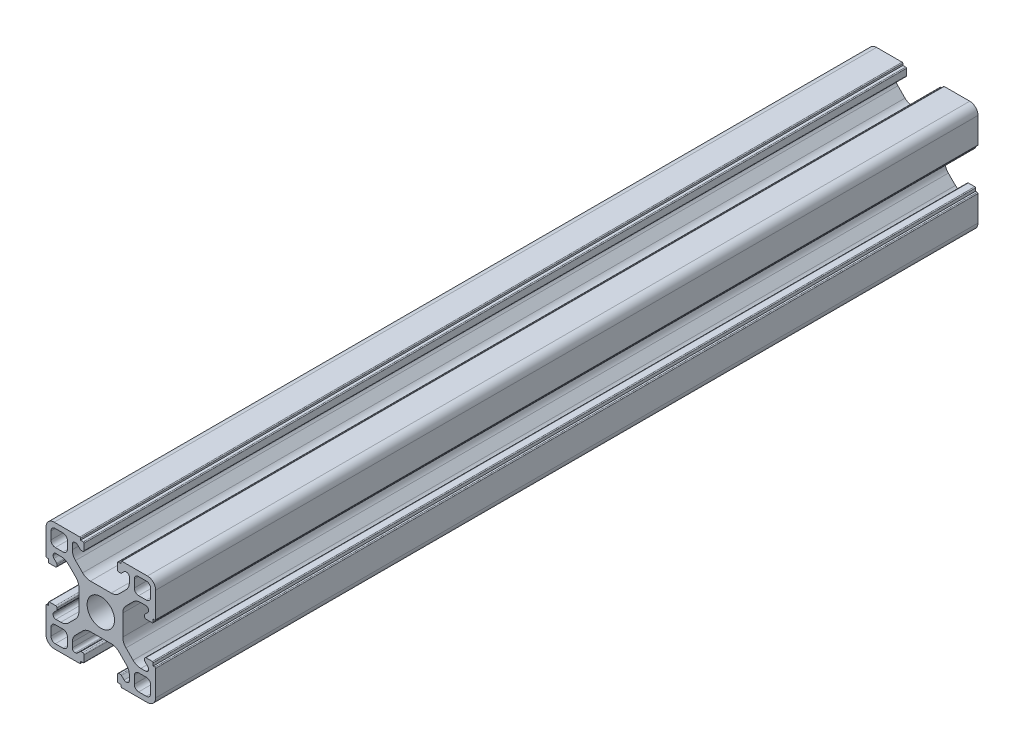
from build123d import *

# Parameters (mm, degrees)
EXTRUDE_1_DEPTH = 150


with BuildPart() as part:
    # Эскиз1 → Бобышка-Вытянуть1 (new body)
    with BuildSketch(Plane.XY):
        with BuildLine():
            Line((-31.105150957, 65.209647948), (-29.206370287, 65.209647948))
            ThreePointArc((-29.206370287, 65.209647948), (-28.441003423, 65.361888883), (-27.792156725, 65.795434385))
            Line((-27.792156725, 65.795434385), (-26.490937394, 67.096653716))
            ThreePointArc((-26.490937394, 67.096653716), (-26.057391892, 67.745500414), (-25.905150957, 68.510867279))
            Line((-25.905150957, 68.510867279), (-25.905150957, 69.409647948))
            ThreePointArc((-25.905150957, 69.409647948), (-26.051597566, 69.763201338), (-26.405150957, 69.909647948))
            Line((-26.405150957, 69.909647948), (-26.508044175, 69.909647948))
            ThreePointArc((-26.508044175, 69.909647948), (-26.699385892, 69.871587714), (-26.861597566, 69.763201338))
            Line((-26.861597566, 69.763201338), (-27.341927652, 69.282871252))
            ThreePointArc((-27.341927652, 69.282871252), (-27.423033489, 69.228678065), (-27.518704347, 69.209647948))
            Line((-27.518704347, 69.209647948), (-27.805150957, 69.209647948))
            ThreePointArc((-27.805150957, 69.209647948), (-27.981927652, 69.282871252), (-28.055150957, 69.459647948))
            Line((-28.055150957, 69.459647948), (-28.055150957, 70.608718768))
            ThreePointArc((-28.055150957, 70.608718768), (-28.011216974, 70.714784785), (-27.905150957, 70.758718768))
            Line((-27.905150957, 70.758718768), (-27.405150957, 70.758718768))
            Line((-27.405150957, 70.758718768), (-27.405150957, 71.059647948))
            ThreePointArc((-27.405150957, 71.059647948), (-27.361216974, 71.165713965), (-27.255150957, 71.209647948))
            Line((-27.255150957, 71.209647948), (-22.605150957, 71.209647948))
            ThreePointArc((-22.605150957, 71.209647948), (-21.544490785, 70.770308119), (-21.105150957, 69.709647948))
            Line((-21.105150957, 69.709647948), (-21.105150957, 65.059647948))
            ThreePointArc((-21.105150957, 65.059647948), (-21.149084939, 64.953581931), (-21.255150957, 64.909647948))
            Line((-21.255150957, 64.909647948), (-21.556080136, 64.909647948))
            Line((-21.556080136, 64.909647948), (-21.556080136, 64.409647948))
            ThreePointArc((-21.556080136, 64.409647948), (-21.600014119, 64.303581931), (-21.706080136, 64.259647948))
            Line((-21.706080136, 64.259647948), (-22.855150957, 64.259647948))
            ThreePointArc((-22.855150957, 64.259647948), (-23.031927652, 64.332871252), (-23.105150957, 64.509647948))
            Line((-23.105150957, 64.509647948), (-23.105150957, 64.796094557))
            ThreePointArc((-23.105150957, 64.796094557), (-23.08612084, 64.891765415), (-23.031927652, 64.972871252))
            Line((-23.031927652, 64.972871252), (-22.551597566, 65.453201338))
            ThreePointArc((-22.551597566, 65.453201338), (-22.44321119, 65.615413013), (-22.405150957, 65.806754729))
            Line((-22.405150957, 65.806754729), (-22.405150957, 65.909647948))
            ThreePointArc((-22.405150957, 65.909647948), (-22.551597566, 66.263201338), (-22.905150957, 66.409647948))
            Line((-22.905150957, 66.409647948), (-23.803931626, 66.409647948))
            ThreePointArc((-23.803931626, 66.409647948), (-24.56929849, 66.257407013), (-25.218145188, 65.82386151))
            Line((-25.218145188, 65.82386151), (-26.519364519, 64.522642179))
            ThreePointArc((-26.519364519, 64.522642179), (-26.952910022, 63.873795482), (-27.105150957, 63.108428617))
            Line((-27.105150957, 63.108428617), (-27.105150957, 61.209647948))
            Line((-27.105150957, 61.209647948), (-27.105150957, 59.310867279))
            ThreePointArc((-27.105150957, 59.310867279), (-26.952910022, 58.545500414), (-26.519364519, 57.896653716))
            Line((-26.519364519, 57.896653716), (-25.218145188, 56.595434385))
            ThreePointArc((-25.218145188, 56.595434385), (-24.56929849, 56.161888883), (-23.803931626, 56.009647948))
            Line((-23.803931626, 56.009647948), (-22.905150957, 56.009647948))
            ThreePointArc((-22.905150957, 56.009647948), (-22.551597566, 56.156094557), (-22.405150957, 56.509647948))
            Line((-22.405150957, 56.509647948), (-22.405150957, 56.612541166))
            ThreePointArc((-22.405150957, 56.612541166), (-22.44321119, 56.803882883), (-22.551597566, 56.966094557))
            Line((-22.551597566, 56.966094557), (-23.031927652, 57.446424643))
            ThreePointArc((-23.031927652, 57.446424643), (-23.08612084, 57.52753048), (-23.105150957, 57.623201338))
            Line((-23.105150957, 57.623201338), (-23.105150957, 57.909647948))
            ThreePointArc((-23.105150957, 57.909647948), (-23.031927652, 58.086424643), (-22.855150957, 58.159647948))
            Line((-22.855150957, 58.159647948), (-21.706080136, 58.159647948))
            ThreePointArc((-21.706080136, 58.159647948), (-21.600014119, 58.115713965), (-21.556080136, 58.009647948))
            Line((-21.556080136, 58.009647948), (-21.556080136, 57.509647948))
            Line((-21.556080136, 57.509647948), (-21.255150957, 57.509647948))
            ThreePointArc((-21.255150957, 57.509647948), (-21.149084939, 57.465713965), (-21.105150957, 57.359647948))
            Line((-21.105150957, 57.359647948), (-21.105150957, 52.709647948))
            ThreePointArc((-21.105150957, 52.709647948), (-21.544490785, 51.648987776), (-22.605150957, 51.209647948))
            Line((-22.605150957, 51.209647948), (-27.255150957, 51.209647948))
            ThreePointArc((-27.255150957, 51.209647948), (-27.361216974, 51.253581931), (-27.405150957, 51.359647948))
            Line((-27.405150957, 51.359647948), (-27.405150957, 51.660577127))
            Line((-27.405150957, 51.660577127), (-27.905150957, 51.660577127))
            ThreePointArc((-27.905150957, 51.660577127), (-28.011216974, 51.70451111), (-28.055150957, 51.810577127))
            Line((-28.055150957, 51.810577127), (-28.055150957, 52.959647948))
            ThreePointArc((-28.055150957, 52.959647948), (-27.981927652, 53.136424643), (-27.805150957, 53.209647948))
            Line((-27.805150957, 53.209647948), (-27.518704347, 53.209647948))
            ThreePointArc((-27.518704347, 53.209647948), (-27.423033489, 53.190617831), (-27.341927652, 53.136424643))
            Line((-27.341927652, 53.136424643), (-26.861597566, 52.656094557))
            ThreePointArc((-26.861597566, 52.656094557), (-26.699385892, 52.547708181), (-26.508044175, 52.509647948))
            Line((-26.508044175, 52.509647948), (-26.405150957, 52.509647948))
            ThreePointArc((-26.405150957, 52.509647948), (-26.051597566, 52.656094557), (-25.905150957, 53.009647948))
            Line((-25.905150957, 53.009647948), (-25.905150957, 53.908428617))
            ThreePointArc((-25.905150957, 53.908428617), (-26.057391892, 54.673795482), (-26.490937394, 55.322642179))
            Line((-26.490937394, 55.322642179), (-27.792156725, 56.62386151))
            ThreePointArc((-27.792156725, 56.62386151), (-28.441003423, 57.057407013), (-29.206370287, 57.209647948))
            Line((-29.206370287, 57.209647948), (-31.105150957, 57.209647948))
            Line((-31.105150957, 57.209647948), (-33.003931626, 57.209647948))
            ThreePointArc((-33.003931626, 57.209647948), (-33.76929849, 57.057407013), (-34.418145188, 56.62386151))
            Line((-34.418145188, 56.62386151), (-35.719364519, 55.322642179))
            ThreePointArc((-35.719364519, 55.322642179), (-36.152910022, 54.673795482), (-36.305150957, 53.908428617))
            Line((-36.305150957, 53.908428617), (-36.305150957, 53.009647948))
            ThreePointArc((-36.305150957, 53.009647948), (-36.158704347, 52.656094557), (-35.805150957, 52.509647948))
            Line((-35.805150957, 52.509647948), (-35.702257738, 52.509647948))
            ThreePointArc((-35.702257738, 52.509647948), (-35.510916022, 52.547708181), (-35.348704347, 52.656094557))
            Line((-35.348704347, 52.656094557), (-34.868374261, 53.136424643))
            ThreePointArc((-34.868374261, 53.136424643), (-34.787268424, 53.190617831), (-34.691597566, 53.209647948))
            Line((-34.691597566, 53.209647948), (-34.405150957, 53.209647948))
            ThreePointArc((-34.405150957, 53.209647948), (-34.228374261, 53.136424643), (-34.155150957, 52.959647948))
            Line((-34.155150957, 52.959647948), (-34.155150957, 51.810577127))
            ThreePointArc((-34.155150957, 51.810577127), (-34.199084939, 51.70451111), (-34.305150957, 51.660577127))
            Line((-34.305150957, 51.660577127), (-34.805150957, 51.660577127))
            Line((-34.805150957, 51.660577127), (-34.805150957, 51.359647948))
            ThreePointArc((-34.805150957, 51.359647948), (-34.849084939, 51.253581931), (-34.955150957, 51.209647948))
            Line((-34.955150957, 51.209647948), (-39.605150957, 51.209647948))
            ThreePointArc((-39.605150957, 51.209647948), (-40.665811128, 51.648987776), (-41.105150957, 52.709647948))
            Line((-41.105150957, 52.709647948), (-41.105150957, 57.359647948))
            ThreePointArc((-41.105150957, 57.359647948), (-41.061216974, 57.465713965), (-40.955150957, 57.509647948))
            Line((-40.955150957, 57.509647948), (-40.654221777, 57.509647948))
            Line((-40.654221777, 57.509647948), (-40.654221777, 58.009647948))
            ThreePointArc((-40.654221777, 58.009647948), (-40.610287794, 58.115713965), (-40.504221777, 58.159647948))
            Line((-40.504221777, 58.159647948), (-39.355150957, 58.159647948))
            ThreePointArc((-39.355150957, 58.159647948), (-39.178374261, 58.086424643), (-39.105150957, 57.909647948))
            Line((-39.105150957, 57.909647948), (-39.105150957, 57.623201338))
            ThreePointArc((-39.105150957, 57.623201338), (-39.124181073, 57.52753048), (-39.178374261, 57.446424643))
            Line((-39.178374261, 57.446424643), (-39.658704347, 56.966094557))
            ThreePointArc((-39.658704347, 56.966094557), (-39.767090723, 56.803882883), (-39.805150957, 56.612541166))
            Line((-39.805150957, 56.612541166), (-39.805150957, 56.509647948))
            ThreePointArc((-39.805150957, 56.509647948), (-39.658704347, 56.156094557), (-39.305150957, 56.009647948))
            Line((-39.305150957, 56.009647948), (-38.406370287, 56.009647948))
            ThreePointArc((-38.406370287, 56.009647948), (-37.641003423, 56.161888883), (-36.992156725, 56.595434385))
            Line((-36.992156725, 56.595434385), (-35.690937394, 57.896653716))
            ThreePointArc((-35.690937394, 57.896653716), (-35.257391892, 58.545500414), (-35.105150957, 59.310867279))
            Line((-35.105150957, 59.310867279), (-35.105150957, 61.209647948))
            Line((-35.105150957, 61.209647948), (-35.105150957, 63.108428617))
            ThreePointArc((-35.105150957, 63.108428617), (-35.257391892, 63.873795482), (-35.690937394, 64.522642179))
            Line((-35.690937394, 64.522642179), (-36.992156725, 65.82386151))
            ThreePointArc((-36.992156725, 65.82386151), (-37.641003423, 66.257407013), (-38.406370287, 66.409647948))
            Line((-38.406370287, 66.409647948), (-39.305150957, 66.409647948))
            ThreePointArc((-39.305150957, 66.409647948), (-39.658704347, 66.263201338), (-39.805150957, 65.909647948))
            Line((-39.805150957, 65.909647948), (-39.805150957, 65.806754729))
            ThreePointArc((-39.805150957, 65.806754729), (-39.767090723, 65.615413013), (-39.658704347, 65.453201338))
            Line((-39.658704347, 65.453201338), (-39.178374261, 64.972871252))
            ThreePointArc((-39.178374261, 64.972871252), (-39.124181073, 64.891765415), (-39.105150957, 64.796094557))
            Line((-39.105150957, 64.796094557), (-39.105150957, 64.509647948))
            ThreePointArc((-39.105150957, 64.509647948), (-39.178374261, 64.332871252), (-39.355150957, 64.259647948))
            Line((-39.355150957, 64.259647948), (-40.504221777, 64.259647948))
            ThreePointArc((-40.504221777, 64.259647948), (-40.610287794, 64.303581931), (-40.654221777, 64.409647948))
            Line((-40.654221777, 64.409647948), (-40.654221777, 64.909647948))
            Line((-40.654221777, 64.909647948), (-40.955150957, 64.909647948))
            ThreePointArc((-40.955150957, 64.909647948), (-41.061216974, 64.953581931), (-41.105150957, 65.059647948))
            Line((-41.105150957, 65.059647948), (-41.105150957, 69.709647948))
            ThreePointArc((-41.105150957, 69.709647948), (-40.665811128, 70.770308119), (-39.605150957, 71.209647948))
            Line((-39.605150957, 71.209647948), (-34.955150957, 71.209647948))
            ThreePointArc((-34.955150957, 71.209647948), (-34.849084939, 71.165713965), (-34.805150957, 71.059647948))
            Line((-34.805150957, 71.059647948), (-34.805150957, 70.758718768))
            Line((-34.805150957, 70.758718768), (-34.305150957, 70.758718768))
            ThreePointArc((-34.305150957, 70.758718768), (-34.199084939, 70.714784785), (-34.155150957, 70.608718768))
            Line((-34.155150957, 70.608718768), (-34.155150957, 69.459647948))
            ThreePointArc((-34.155150957, 69.459647948), (-34.228374261, 69.282871252), (-34.405150957, 69.209647948))
            Line((-34.405150957, 69.209647948), (-34.691597566, 69.209647948))
            ThreePointArc((-34.691597566, 69.209647948), (-34.787268424, 69.228678065), (-34.868374261, 69.282871252))
            Line((-34.868374261, 69.282871252), (-35.348704347, 69.763201338))
            ThreePointArc((-35.348704347, 69.763201338), (-35.510916022, 69.871587714), (-35.702257738, 69.909647948))
            Line((-35.702257738, 69.909647948), (-35.805150957, 69.909647948))
            ThreePointArc((-35.805150957, 69.909647948), (-36.158704347, 69.763201338), (-36.305150957, 69.409647948))
            Line((-36.305150957, 69.409647948), (-36.305150957, 68.510867279))
            ThreePointArc((-36.305150957, 68.510867279), (-36.152910022, 67.745500414), (-35.719364519, 67.096653716))
            Line((-35.719364519, 67.096653716), (-34.418145188, 65.795434385))
            ThreePointArc((-34.418145188, 65.795434385), (-33.76929849, 65.361888883), (-33.003931626, 65.209647948))
            Line((-33.003931626, 65.209647948), (-31.105150957, 65.209647948))
        make_face()
        with BuildLine():
            Line((-24.205150957, 67.309647948), (-22.805150957, 67.309647948))
            ThreePointArc((-22.805150957, 67.309647948), (-22.239465532, 67.543962523), (-22.005150957, 68.109647948))
            Line((-22.005150957, 68.109647948), (-22.005150957, 69.509647948))
            ThreePointArc((-22.005150957, 69.509647948), (-22.239465532, 70.075333373), (-22.805150957, 70.309647948))
            Line((-22.805150957, 70.309647948), (-24.205150957, 70.309647948))
            ThreePointArc((-24.205150957, 70.309647948), (-24.770836381, 70.075333373), (-25.005150957, 69.509647948))
            Line((-25.005150957, 69.509647948), (-25.005150957, 68.109647948))
            ThreePointArc((-25.005150957, 68.109647948), (-24.770836381, 67.543962523), (-24.205150957, 67.309647948))
        make_face(mode=Mode.SUBTRACT)
        with BuildLine():
            Line((-25.005150957, 54.309647948), (-25.005150957, 52.909647948))
            ThreePointArc((-25.005150957, 52.909647948), (-24.770836381, 52.343962523), (-24.205150957, 52.109647948))
            Line((-24.205150957, 52.109647948), (-22.805150957, 52.109647948))
            ThreePointArc((-22.805150957, 52.109647948), (-22.239465532, 52.343962523), (-22.005150957, 52.909647948))
            Line((-22.005150957, 52.909647948), (-22.005150957, 54.309647948))
            ThreePointArc((-22.005150957, 54.309647948), (-22.239465532, 54.875333373), (-22.805150957, 55.109647948))
            Line((-22.805150957, 55.109647948), (-24.205150957, 55.109647948))
            ThreePointArc((-24.205150957, 55.109647948), (-24.770836381, 54.875333373), (-25.005150957, 54.309647948))
        make_face(mode=Mode.SUBTRACT)
        with BuildLine():
            Line((-38.005150957, 55.109647948), (-39.405150957, 55.109647948))
            ThreePointArc((-39.405150957, 55.109647948), (-39.970836381, 54.875333373), (-40.205150957, 54.309647948))
            Line((-40.205150957, 54.309647948), (-40.205150957, 52.909647948))
            ThreePointArc((-40.205150957, 52.909647948), (-39.970836381, 52.343962523), (-39.405150957, 52.109647948))
            Line((-39.405150957, 52.109647948), (-38.005150957, 52.109647948))
            ThreePointArc((-38.005150957, 52.109647948), (-37.439465532, 52.343962523), (-37.205150957, 52.909647948))
            Line((-37.205150957, 52.909647948), (-37.205150957, 54.309647948))
            ThreePointArc((-37.205150957, 54.309647948), (-37.439465532, 54.875333373), (-38.005150957, 55.109647948))
        make_face(mode=Mode.SUBTRACT)
        with BuildLine():
            Line((-37.205150957, 68.109647948), (-37.205150957, 69.509647948))
            ThreePointArc((-37.205150957, 69.509647948), (-37.439465532, 70.075333373), (-38.005150957, 70.309647948))
            Line((-38.005150957, 70.309647948), (-39.405150957, 70.309647948))
            ThreePointArc((-39.405150957, 70.309647948), (-39.970836381, 70.075333373), (-40.205150957, 69.509647948))
            Line((-40.205150957, 69.509647948), (-40.205150957, 68.109647948))
            ThreePointArc((-40.205150957, 68.109647948), (-39.970836381, 67.543962523), (-39.405150957, 67.309647948))
            Line((-39.405150957, 67.309647948), (-38.005150957, 67.309647948))
            ThreePointArc((-38.005150957, 67.309647948), (-37.439465532, 67.543962523), (-37.205150957, 68.109647948))
        make_face(mode=Mode.SUBTRACT)
        with BuildLine():
            ThreePointArc((-28.605150957, 61.209647948), (-29.337384004, 62.977414901), (-31.105150957, 63.709647948))
            ThreePointArc((-31.105150957, 63.709647948), (-32.87291791, 62.977414901), (-33.605150957, 61.209647948))
            ThreePointArc((-33.605150957, 61.209647948), (-32.87291791, 59.441880995), (-31.105150957, 58.709647948))
            ThreePointArc((-31.105150957, 58.709647948), (-29.337384004, 59.441880995), (-28.605150957, 61.209647948))
        make_face(mode=Mode.SUBTRACT)
    extrude(amount=EXTRUDE_1_DEPTH)


solid = part.part
